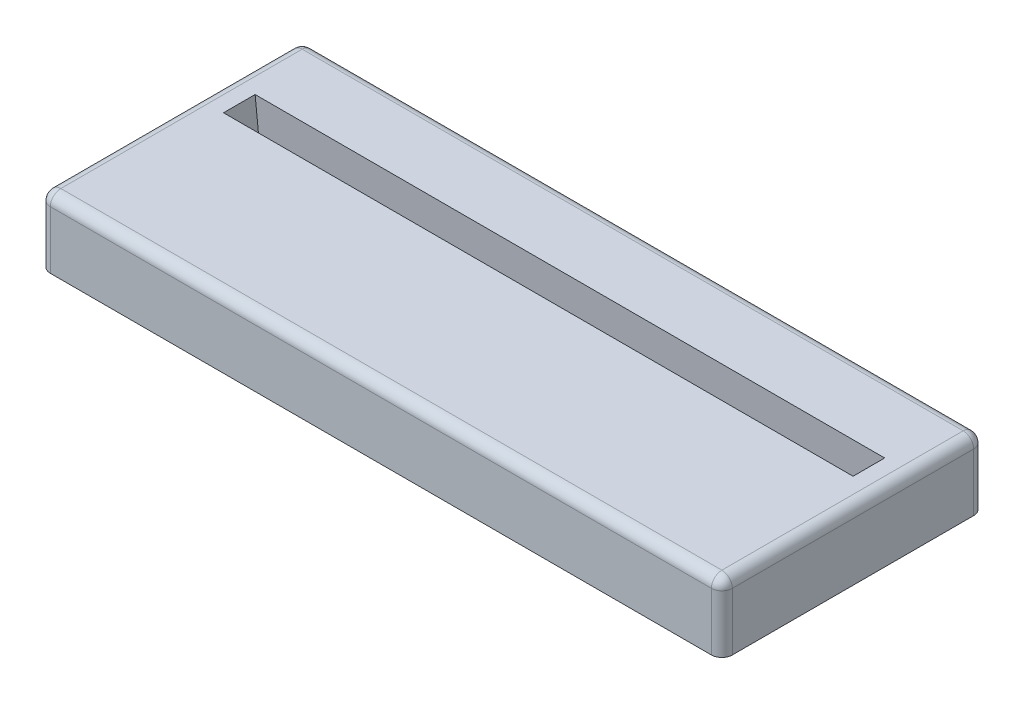
from build123d import *

# Parameters (mm, degrees)
P_IDAT_VYSUNUT_M10_DEPTH   = 120
P_IDAT_VYSUNUT_M10_2_DEPTH = 120
SKICA8_3_W                 = 50
SKICA8_3_H                 = 13
P_IDAT_VYSUNUT_M11_DEPTH   = 5
SKICA12_W                  = 50
SKICA12_H                  = 13
P_IDAT_VYSUNUT_M13_DEPTH   = 5
SKICA13_W                  = 126.2
SKICA13_H                  = 46.2
SKICA13_W_2                = 123.8
SKICA13_H_2                = 43.8
ODEBRAT_VYSUNUT_M1_DEPTH   = 7
ZAOBLIT2_R                 = 2


with BuildPart() as part:
    # Skica8 → Přidat vysunutím10 (new body)
    with BuildSketch(Plane(origin=(0, 0, 0), x_dir=(0, 0, -1), z_dir=(1, 0, 0))):
        Polygon((6, -3.927822333), (5.008609938, 6.5), (-25, 6.5), (-25, -6.5), (7.5, -6.5), (7.5, -3.785214889), align=None)
    extrude(amount=P_IDAT_VYSUNUT_M10_DEPTH)



with BuildPart() as body_2:
    # Skica8 → P_idat vysunut_m10 2 (new body)
    with BuildSketch(Plane(origin=(0, 0, 0), x_dir=(0, 0, -1), z_dir=(1, 0, 0))):
        Polygon((25, 6.5), (11.035664785, 6.5), (11.973066599, -3.359953158), (10.5, -3.5), (10.5, -6.5), (25, -6.5), align=None)
    extrude(amount=P_IDAT_VYSUNUT_M10_2_DEPTH)


with BuildPart() as part_1:
    add(part.part)

    add(body_2.part)  # Přidat vysunutím11 merges body 2
    # Skica8<3> → Přidat vysunutím11 (add)
    with BuildSketch(Plane(origin=(0, 0, 0), x_dir=(0, 0, -1), z_dir=(1, 0, 0))):
        Rectangle(SKICA8_3_W, SKICA8_3_H)
    extrude(amount=-P_IDAT_VYSUNUT_M11_DEPTH)

    # Skica12 → Přidat vysunutím13 (add)
    with BuildSketch(Plane(origin=(120, 0, 0), x_dir=(0, 0, -1), z_dir=(1, 0, 0))):
        Rectangle(SKICA12_W, SKICA12_H)
    extrude(amount=P_IDAT_VYSUNUT_M13_DEPTH)

    # Skica13 → Odebrat vysunutím1 (cut)
    with BuildSketch(Plane.XZ.offset(6.5)):
        with Locations((60, 0)):
            Rectangle(SKICA13_W, SKICA13_H)
        with Locations((60, 0)):
            Rectangle(SKICA13_W_2, SKICA13_H_2, mode=Mode.SUBTRACT)
    extrude(amount=-ODEBRAT_VYSUNUT_M1_DEPTH, mode=Mode.SUBTRACT)

    # Zaoblit2
    zaoblit2_edges = [part_1.edges().sort_by_distance(p)[0] for p in [
        (-5, 6.5, 0),
        (60, 6.5, -25),
        (125, 6.5, 0),
        (60, 6.5, 25),
        (125, 0, 25),
        (-5, 0, 25),
        (-5, 0, -25),
        (125, 0, -25),
    ]]
    fillet(zaoblit2_edges, radius=ZAOBLIT2_R)


solid = part_1.part
